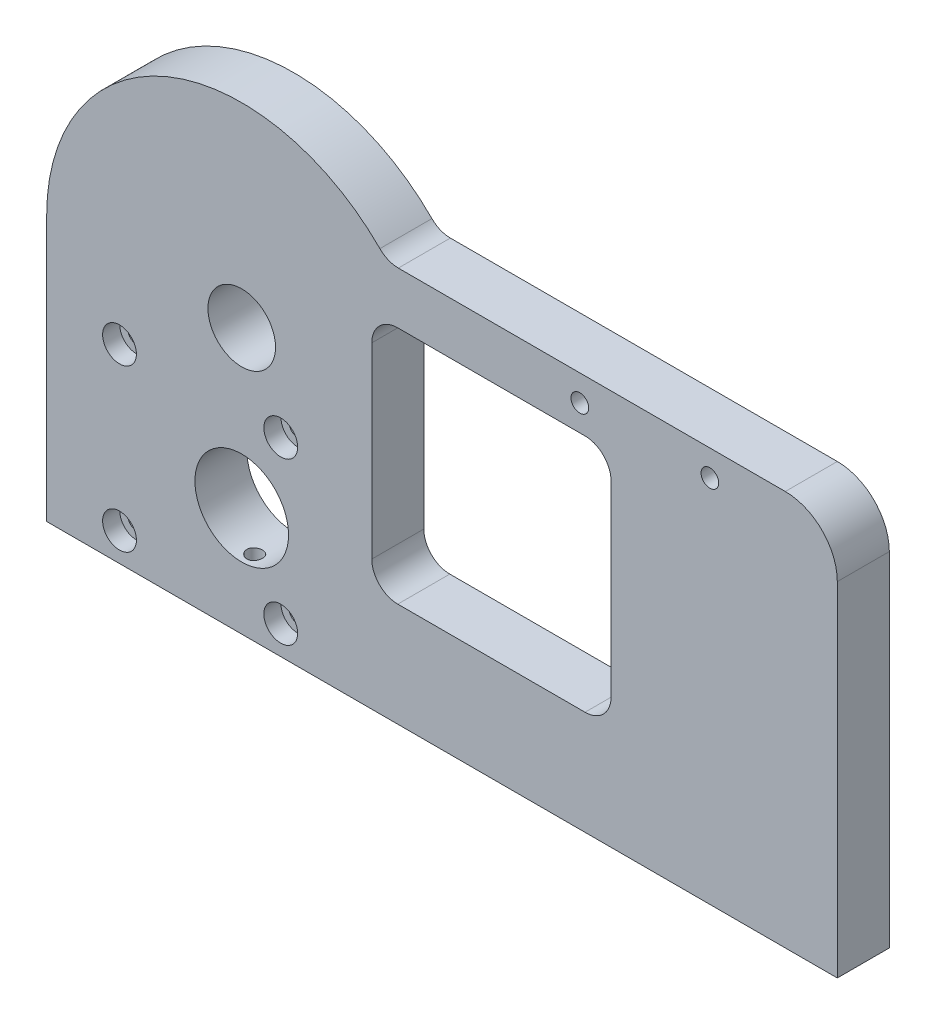
from build123d import *

# Parameters (mm, degrees)
BOSS_EXTRUDE1_DEPTH                      = 10
FILLET1_R                                = 5
FILLET2_R                                = 10
SKETCH2_R                                = 9
CUT_EXTRUDE1_DEPTH                       = 177.171081622
SKETCH3_R                                = 6.5
CUT_EXTRUDE2_DEPTH                       = 177.171081622
SKETCH4_W                                = 46
SKETCH4_H                                = 46
CUT_EXTRUDE3_DEPTH                       = 177.171081622
CUT_EXTRUDE4_REACH                       = 178.171
CUT_EXTRUDE4_END_RADIUS                  = 9
SKETCH5_R                                = 1.5
FILLET3_R                                = 5
M3X0_5_TAPPED_HOLE1_D                    = 2.6
M3X0_5_TAPPED_HOLE1_DEPTH                = 9
M3X0_5_TAPPED_HOLE1_TIP                  = 0.781118805
CBORE_FOR_M3_PAN_HEAD_SCREW1_D           = 3.4
CBORE_FOR_M3_PAN_HEAD_SCREW1_CBORE_D     = 6.5
CBORE_FOR_M3_PAN_HEAD_SCREW1_CBORE_DEPTH = 3.3
CBORE_FOR_M3_PAN_HEAD_SCREW2_D           = 3.4
CBORE_FOR_M3_PAN_HEAD_SCREW2_CBORE_D     = 6.5
CBORE_FOR_M3_PAN_HEAD_SCREW2_CBORE_DEPTH = 3.3


with BuildPart() as part:
    # Sketch1 → Boss-Extrude1 (new body)
    with BuildSketch(Plane.XY):
        with BuildLine():
            Line((0, 0), (152, 0))
            Line((152, 0), (152, 76))
            Line((152, 76), (65.450849719, 76))
            ThreePointArc((65.450849719, 76), (24.119171634, 86.031463461), (0, 51))
            Line((0, 51), (0, 0))
        make_face()
    extrude(amount=BOSS_EXTRUDE1_DEPTH)

    # Fillet1
    fillet1_edges = [part.edges().sort_by_distance(p)[0] for p in [
        (65.450849719, 76, 5),
    ]]
    fillet(fillet1_edges, radius=FILLET1_R)

    # Fillet2
    fillet2_edges = [part.edges().sort_by_distance(p)[0] for p in [
        (152, 76, 5),
    ]]
    fillet(fillet2_edges, radius=FILLET2_R)

    # Sketch2 → Cut-Extrude1 (cut, through all)
    with BuildSketch(Plane.XY.offset(10)):
        with Locations((37.5, 21)):
            Circle(SKETCH2_R)
    extrude(amount=-CUT_EXTRUDE1_DEPTH, mode=Mode.SUBTRACT)

    # Sketch3 → Cut-Extrude2 (cut, through all)
    with BuildSketch(Plane.XY.offset(10)):
        with Locations((37.5, 51)):
            Circle(SKETCH3_R)
    extrude(amount=-CUT_EXTRUDE2_DEPTH, mode=Mode.SUBTRACT)

    # Sketch4 → Cut-Extrude3 (cut, through all)
    with BuildSketch(Plane.XY.offset(10)):
        with Locations((85.5, 43)):
            Rectangle(SKETCH4_W, SKETCH4_H)
    extrude(amount=-CUT_EXTRUDE3_DEPTH, mode=Mode.SUBTRACT)

    # Cut-Extrude4: up to this cylinder (the profile starts outside it)
    cut_extrude4_end = Plane(origin=(37.5, 21, 7.5), z_dir=(0, 0, 1)) * Cylinder(CUT_EXTRUDE4_END_RADIUS, 375.342, mode=Mode.PRIVATE)
    # Sketch5 → Cut-Extrude4 (cut, up to the surface)
    with BuildSketch(Plane.XZ, mode=Mode.PRIVATE) as cut_extrude4_sk1:
        with Locations(Location((37.5, 7.5, 0), (0, 0, 270))):
            Circle(SKETCH5_R)
    cut_extrude4_tool1 = extrude(cut_extrude4_sk1.sketch, amount=-CUT_EXTRUDE4_REACH, mode=Mode.PRIVATE) - cut_extrude4_end
    add(cut_extrude4_tool1.solids().sort_by_distance((37.5, 0, 7.5))[0], mode=Mode.SUBTRACT)

    # Fillet3
    fillet3_edges = [part.edges().sort_by_distance(p)[0] for p in [
        (62.5, 20, 5),
        (62.5, 66, 5),
        (108.5, 66, 5),
        (108.5, 20, 5),
    ]]
    fillet(fillet3_edges, radius=FILLET3_R)

    # M3x0.5 Tapped Hole1
    with Locations(Plane(origin=(0, 0, 0), x_dir=(-1, 0, 0), z_dir=(0, -1, 0))):
        with Locations((-16, -5), (-56, -5), (-96, -5), (-136, -5)):
            Hole(M3X0_5_TAPPED_HOLE1_D / 2, depth=M3X0_5_TAPPED_HOLE1_DEPTH)
            with Locations((0, 0, -(M3X0_5_TAPPED_HOLE1_DEPTH + M3X0_5_TAPPED_HOLE1_TIP / 2))):  # 118° drill point
                Cone(0, M3X0_5_TAPPED_HOLE1_D / 2, M3X0_5_TAPPED_HOLE1_TIP, mode=Mode.SUBTRACT)

    # CBORE for M3 Pan Head Screw1 (through all)
    with Locations(Plane.XY.offset(10)):
        with Locations((14, 36.5), (45, 36.5), (45, 5.5), (14, 5.5)):
            CounterBoreHole(CBORE_FOR_M3_PAN_HEAD_SCREW1_D / 2, CBORE_FOR_M3_PAN_HEAD_SCREW1_CBORE_D / 2, CBORE_FOR_M3_PAN_HEAD_SCREW1_CBORE_DEPTH)

    # CBORE for M3 Pan Head Screw2 (through all)
    with Locations(Plane(origin=(0, 0, 0), x_dir=(-1, 0, 0), z_dir=(0, 0, -1))):
        with Locations((-127.5, 71), (-102.5, 71)):
            CounterBoreHole(CBORE_FOR_M3_PAN_HEAD_SCREW2_D / 2, CBORE_FOR_M3_PAN_HEAD_SCREW2_CBORE_D / 2, CBORE_FOR_M3_PAN_HEAD_SCREW2_CBORE_DEPTH)


solid = part.part
